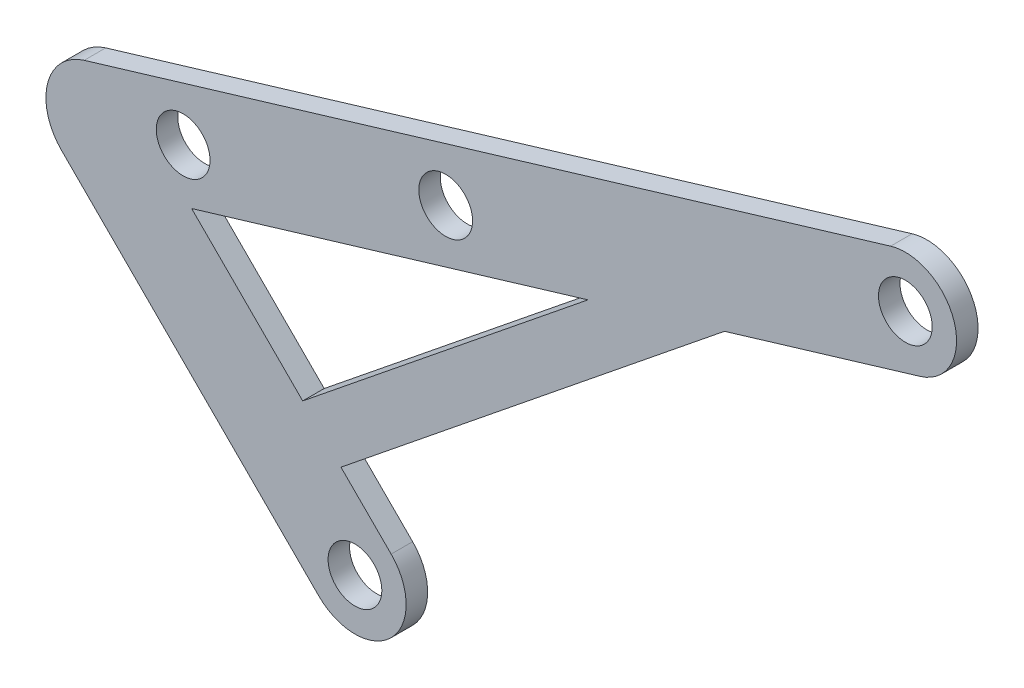
from build123d import *

# Parameters (mm, degrees)
SKETCH2_R           = 5
BOSS_EXTRUDE3_DEPTH = 4
FILLET3_R           = 10
SKETCH5_R           = 5
CUT_EXTRUDE3_DEPTH  = 4


with BuildPart() as part:
    # Sketch2 → Boss-Extrude3 (new body)
    # profile 1 of 2: a face of its own
    with BuildSketch(Plane.XY):
        with BuildLine():
            ThreePointArc((14.959120664, 109.549078448), (26.821882285, 103.16737517), (20.440179007, 91.304613549))
            Line((20.440179007, 91.304613549), (-115.084548239, 50.589857539))
            Line((-115.084548239, 50.589857539), (-77.965074882, 13.470384182))
            ThreePointArc((-77.965074882, 13.470384182), (-77.965074882, 0), (-91.435459064, 0))
            Line((-91.435459064, 0), (-151.097343154, 59.661884091))
            Line((-151.097343154, 59.661884091), (14.959120664, 109.549078448))
        make_face()
        with Locations((17.699649835, 100.426845999)):
            Circle(SKETCH2_R, mode=Mode.SUBTRACT)
        with Locations((-84.700266973, 6.735192091)):
            Circle(SKETCH2_R, mode=Mode.SUBTRACT)
    # profile 2 of 2: a face of its own
    with BuildSketch(Plane.XY):
        Polygon((-94.417910685, 29.923219984), (-87.300193609, 22.805502909), (-15.947819408, 80.372818981), (-41.344385101, 72.743104488), align=None)
    extrude(amount=BOSS_EXTRUDE3_DEPTH)

    # Fillet3
    fillet3_edges = [part.edges().sort_by_distance(p)[0] for p in [
        (-151.097343154, 59.661884091, 2),
    ]]
    fillet(fillet3_edges, radius=FILLET3_R)

    # Sketch5 → Cut-Extrude3 (cut)
    with BuildSketch(Plane.XY.offset(4)):
        with Locations((-116.663330616, 60.061105539)):
            Circle(SKETCH5_R)
        with Locations((-67.81988128, 74.734805039)):
            Circle(SKETCH5_R)
    extrude(amount=-CUT_EXTRUDE3_DEPTH, mode=Mode.SUBTRACT)


solid = part.part
